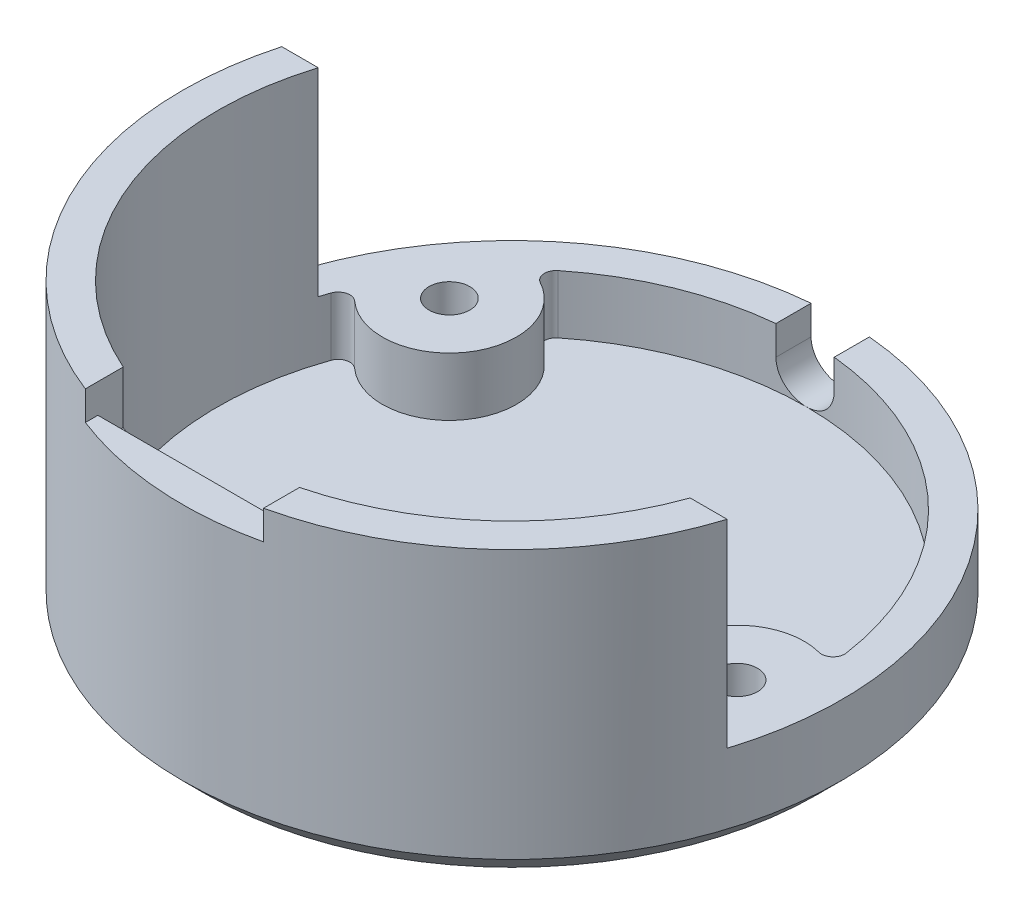
from build123d import *

# Parameters (mm, degrees)
SKETCH1_R           = 28.25
BOSS_EXTRUDE1_DEPTH = 25
SHELL1_T            = -3
CUT_EXTRUDE1_DEPTH  = 17
SKETCH3_W           = 16.5
SKETCH3_H           = 5.174038482
CUT_EXTRUDE2_DEPTH  = 2.5
CUT_EXTRUDE3_DEPTH  = 48.128812843
SKETCH6_R           = 3.25
CUT_EXTRUDE4_DEPTH  = 46.608387559
SKETCH7_R           = 5.75
SKETCH7_R_2         = 1.75
BOSS_EXTRUDE2_DEPTH = 5
FILLET1_R           = 1
CHAMFER1_SIZE       = 2
SKETCH8_W           = 16.5
SKETCH8_H           = 2.174038482
CUT_EXTRUDE5_DEPTH  = 2


with BuildPart() as part:
    # Sketch1 → Boss-Extrude1 (new body)
    with BuildSketch(Plane(origin=(0, 0, 0), x_dir=(1, 0, 0), z_dir=(0, 1, 0))):
        with Locations(Location((0, 0, 0), (0, 0, 270))):
            Circle(SKETCH1_R)
    extrude(amount=BOSS_EXTRUDE1_DEPTH)

    # Shell1
    shell1_openings = [part.faces().sort_by_distance(p)[0] for p in [
        (0, 25, 0),
    ]]
    offset(amount=SHELL1_T, openings=shell1_openings, kind=Kind.INTERSECTION)

    # Sketch2 → Cut-Extrude1 (cut)
    with BuildSketch(Plane(origin=(0, 25, 0), x_dir=(1, 0, 0), z_dir=(0, 1, 0))):
        Polygon((0, 7.5), (-28.25, 7.5), (-28.25, 28.25), (28.25, 28.25), (28.25, -8.5), (0, -8.5), align=None)
    extrude(amount=-CUT_EXTRUDE1_DEPTH, mode=Mode.SUBTRACT)

    # Sketch3 → Cut-Extrude2 (cut)
    with BuildSketch(Plane(origin=(0, 25, 0), x_dir=(1, 0, 0), z_dir=(0, 1, 0))):
        with Locations((-2, -25.662980759)):
            Rectangle(SKETCH3_W, SKETCH3_H)
    extrude(amount=-CUT_EXTRUDE2_DEPTH, mode=Mode.SUBTRACT)

    # Sketch5 → Cut-Extrude3 (cut, through all)
    with BuildSketch(Plane.XY):
        with BuildLine():
            Line((2.5, 8), (2.5, 5.5))
            ThreePointArc((2.5, 5.5), (1.767766953, 3.732233047), (0, 3))
            ThreePointArc((0, 3), (-1.767766953, 3.732233047), (-2.5, 5.5))
            Line((-2.5, 5.5), (-2.5, 8))
            Line((-2.5, 8), (2.5, 8))
        make_face()
    extrude(amount=-CUT_EXTRUDE3_DEPTH, mode=Mode.SUBTRACT)

    # Sketch6 → Cut-Extrude4 (cut, through all)
    with BuildSketch(Plane(origin=(0, 3, 0), x_dir=(1, 0, 0), z_dir=(0, 1, 0))):
        with Locations(Location((-18.364367672, 13, 0), (0, 0, 270))):
            Circle(SKETCH6_R)
        with Locations(Location((22.299103121, -3, 0), (0, 0, 270))):
            Circle(SKETCH6_R)
    extrude(amount=-CUT_EXTRUDE4_DEPTH, mode=Mode.SUBTRACT)

    # Sketch7 → Boss-Extrude2 (add)
    # profile 1 of 2: a face of its own
    with BuildSketch(Plane(origin=(0, 3, 0), x_dir=(1, 0, 0), z_dir=(0, 1, 0))):
        with Locations((-18.364367672, 13)):
            Circle(SKETCH7_R)
        with Locations(Location((-18.364367672, 13, 0), (0, 0, 90))):
            Circle(SKETCH7_R_2, mode=Mode.SUBTRACT)
    # profile 2 of 2: a face of its own
    with BuildSketch(Plane(origin=(0, 3, 0), x_dir=(1, 0, 0), z_dir=(0, 1, 0))):
        with Locations((22.299103121, -3)):
            Circle(SKETCH7_R)
        with Locations(Location((22.299103121, -3, 0), (0, 0, 90))):
            Circle(SKETCH7_R_2, mode=Mode.SUBTRACT)
    extrude(amount=BOSS_EXTRUDE2_DEPTH)

    # Fillet1
    fillet1_edges = [part.edges().sort_by_distance(p)[0] for p in [
        (-23.219797584, 5.5, -9.919853839),
        (-17.072985413, 5.5, -18.603109124),
        (23.753694458, 5.5, 8.56297259),
        (25.172189575, 5.5, -1.980750368),
    ]]
    fillet(fillet1_edges, radius=FILLET1_R)

    # Chamfer1
    chamfer1_edges = [part.edges().sort_by_distance(p)[0] for p in [
        (0, 0, -28.25),
    ]]
    chamfer(chamfer1_edges, length=CHAMFER1_SIZE)

    # Sketch8 → Cut-Extrude5 (cut)
    with BuildSketch(Plane(origin=(0, 22.5, 0), x_dir=(1, 0, 0), z_dir=(0, 1, 0))):
        with Locations((-2, -24.162980759)):
            Rectangle(SKETCH8_W, SKETCH8_H)
    extrude(amount=-CUT_EXTRUDE5_DEPTH, mode=Mode.SUBTRACT)


solid = part.part
